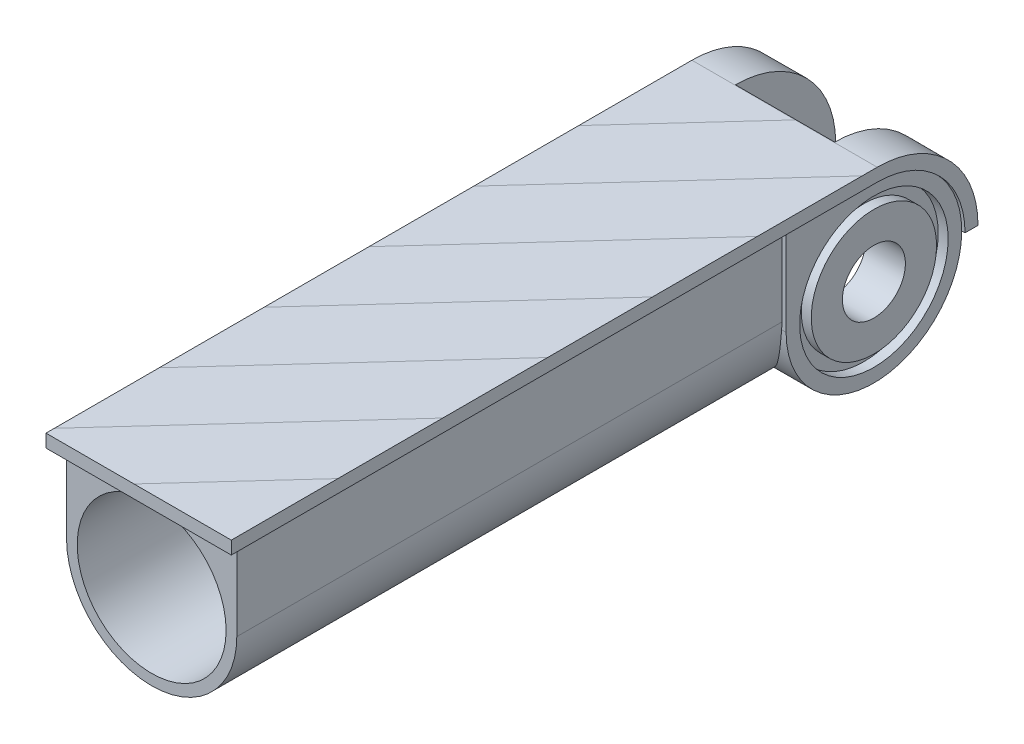
from build123d import *

# Parameters (mm, degrees)
EXTRUDE1_DEPTH      = 55.794498856
EXTRUDE6_DEPTH      = 9.14463492
EXTRUDE7_REACH      = 59.365
EXTRUDE_THIN1_DEPTH = 9.483751535
SKETCH9_R           = 7.60188161
SKETCH9_R_2         = 6.414649529
EXTRUDE8_DEPTH      = 1.016
SKETCH10_R          = 3.224544811
EXTRUDE9_DEPTH      = 61.86360078
SKETCH2_R           = 7.62
EXTRUDE11_DEPTH     = 55.88
SKETCH12_R          = 9.016750803
EXTRUDE12_DEPTH     = 5.08
SKETCH13_W          = 10.16
SKETCH13_H          = 19.30498436
EXTRUDE13_DEPTH     = 59.71373486
SKETCH16_W          = 10.16
SKETCH16_H          = 10.249002979
EXTRUDE16_DEPTH     = 59.71373486


with BuildPart() as part:
    # Sketch1 → Extrude1 (new body)
    with BuildSketch(Plane.XY):
        with BuildLine():
            Line((-8.715458206, 8.280410535), (8.715458206, 8.280410535))
            Line((8.715458206, 8.280410535), (8.715458206, 0))
            ThreePointArc((8.715458206, 0), (0, -8.715458206), (-8.715458206, 0))
            Line((-8.715458206, 0), (-8.715458206, 8.280410535))
        make_face()
    extrude(amount=EXTRUDE1_DEPTH)

    # Sketch6 → Extrude6 (add, symmetric)
    with BuildSketch(Plane(origin=(0, 0, 0), x_dir=(0, 0, -1), z_dir=(1, 0, 0))):
        with BuildLine():
            Line((0, 8.280410535), (8.988874968, 8.280410535))
            ThreePointArc((8.988874968, 8.280410535), (15.344969413, -7.064558879), (0, -0.708464433))
            Line((0, -0.708464433), (0, 8.280410535))
        make_face()
    extrude(amount=EXTRUDE6_DEPTH, both=True)

    # Sketch7 → Extrude7 (add, up to next)
    with BuildSketch(Plane(origin=(0, 0, 0), x_dir=(-1, 0, 0), z_dir=(0, 0, -1)), mode=Mode.PRIVATE) as extrude7_sk1:
        with BuildLine():
            Line((8.68661556, -0.708464433), (-8.68661556, -0.708464433))
            ThreePointArc((-8.68661556, -0.708464433), (0, -8.715458206), (8.68661556, -0.708464433))
        make_face()
    extrude7_tool1 = extrude(extrude7_sk1.sketch, amount=EXTRUDE7_REACH, mode=Mode.PRIVATE) - part.part
    add(extrude7_tool1.solids().sort_by_distance((0, -4.084646, 0))[0])

    # Sketch8 → Extrude-Thin1 (add, symmetric)
    with BuildSketch(Plane(origin=(0, 0, 0), x_dir=(0, 0, -1), z_dir=(1, 0, 0))):
        with BuildLine():
            ThreePointArc((17.977749936, -0.708464433), (15.344969413, 5.647630012), (8.988874968, 8.280410535))
            Line((8.988874968, 8.280410535), (0, 8.280410535))
            Line((0, 8.280410535), (-57.125499776, 8.280410535))
            Line((-57.125499776, 8.280410535), (-57.125499776, 9.607644959))
            Line((-57.125499776, 9.607644959), (0, 9.607644959))
            Line((0, 9.607644959), (8.988874968, 9.607644959))
            ThreePointArc((8.988874968, 9.607644959), (16.283465875, 6.586126473), (19.30498436, -0.708464433))
            Line((19.30498436, -0.708464433), (17.977749936, -0.708464433))
        make_face()
    extrude(amount=EXTRUDE_THIN1_DEPTH, both=True)

    # Sketch9 → Extrude8 (cut)
    with BuildSketch(Plane(origin=(9.14463492, 0, 0), x_dir=(0, 0, -1), z_dir=(1, 0, 0))):
        with Locations((8.988874968, -0.708464433)):
            Circle(SKETCH9_R)
        with Locations((8.988874968, -0.708464433)):
            Circle(SKETCH9_R_2, mode=Mode.SUBTRACT)
    extrude8 = extrude(amount=-EXTRUDE8_DEPTH, mode=Mode.SUBTRACT)

    # Sketch10 → Extrude9 (cut, through all)
    with BuildSketch(Plane(origin=(9.14463492, 0, 0), x_dir=(0, 0, -1), z_dir=(1, 0, 0))):
        with Locations((8.988874968, -0.708464433)):
            Circle(SKETCH10_R)
    extrude(amount=-EXTRUDE9_DEPTH, mode=Mode.SUBTRACT)

    # Mirror1: Extrude8 across plane
    add(extrude8.mirror(Plane(origin=(0, 0, 0), x_dir=(0, 0, 1), z_dir=(1, 0, 0))), mode=Mode.SUBTRACT)

    # Sketch2 → Extrude11 (cut)
    with BuildSketch(Plane.XY.offset(55.794498856)):
        Circle(SKETCH2_R)
    extrude(amount=-EXTRUDE11_DEPTH, mode=Mode.SUBTRACT)

    # Sketch12 → Extrude12 (cut, symmetric)
    with BuildSketch(Plane(origin=(0, 0, 0), x_dir=(0, 0, -1), z_dir=(1, 0, 0))):
        with Locations((8.988874968, -0.708464433)):
            Circle(SKETCH12_R)
    extrude(amount=EXTRUDE12_DEPTH, both=True, mode=Mode.SUBTRACT)

    # Sketch13 → Extrude13 (cut, through all)
    with BuildSketch(Plane(origin=(0, 0, 0), x_dir=(1, 0, 0), z_dir=(0, 1, 0))):
        with Locations((0, 9.65249218)):
            Rectangle(SKETCH13_W, SKETCH13_H)
    extrude(amount=-EXTRUDE13_DEPTH, mode=Mode.SUBTRACT)

    # Sketch16 → Extrude16 (cut, through all)
    with BuildSketch(Plane(origin=(0, 0, 0), x_dir=(1, 0, 0), z_dir=(0, 1, 0))):
        with Locations((0, 14.15612703)):
            Rectangle(SKETCH16_W, SKETCH16_H)
    extrude(amount=EXTRUDE16_DEPTH, mode=Mode.SUBTRACT)


solid = part.part
